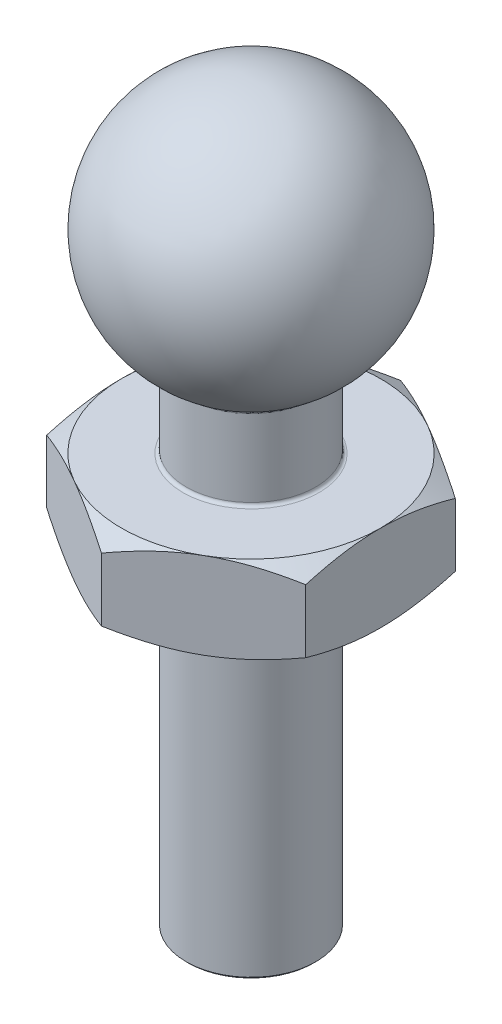
from build123d import *

# Parameters (mm, degrees)
CHAMFER1_SIZE           = 0.05
BOSS_EXTRUDE1_START     = 2
SKETCH3_R               = 1.5
BOSS_EXTRUDE1_DEPTH     = 2
SKETCH5_OUTSIDE_W       = 18.79
SKETCH5_OUTSIDE_H       = 19.718
SKETCH5_OUTSIDE_R       = 3
CUT_EXTRUDE1_DEPTH      = 2
CUT_EXTRUDE1_DRAFT      = -60
MIRROR1_COPY_1_SKETCH_W = 18.79
MIRROR1_COPY_1_SKETCH_H = 19.718
MIRROR1_COPY_1_SKETCH_R = 3
MIRROR1_COPY_1_DEPTH    = 2
MIRROR1_COPY_1_DRAFT    = -60
FILLET1_R               = 0.075


with BuildPart() as part:
    # Sketch1 → Revolve1 (revolve)
    with BuildSketch(Plane.XY):
        with BuildLine():
            Line((0, 17), (0, 0))
            Line((0, 0), (1.5, 0))
            Line((1.5, 0), (1.5, 11.401923789))
            ThreePointArc((1.5, 11.401923789), (2.897777479, 14.776457135), (0, 17))
        make_face()
    revolve(axis=Axis((0, 17, 0), (0, -1, 0)))

    # Chamfer1
    chamfer1_edges = [part.edges().sort_by_distance(p)[0] for p in [
        (-1.5, 0, 0),
    ]]
    chamfer(chamfer1_edges, length=CHAMFER1_SIZE)

    # Sketch3 → Boss-Extrude1 (add)
    with BuildSketch(Plane(origin=(0, 7.5, 0), x_dir=(1, 0, 0), z_dir=(0, 1, 0)).offset(BOSS_EXTRUDE1_START)):
        Polygon((3, 1.732050808), (0, 3.464101615), (-3, 1.732050808), (-3, -1.732050808), (0, -3.464101615), (3, -1.732050808), align=None)
        with Locations(Location((0, 0, 0), (0, 0, 270))):
            Circle(SKETCH3_R, mode=Mode.SUBTRACT)
    extrude(amount=-BOSS_EXTRUDE1_DEPTH)


with BuildPart() as cut_extrude1_tool:
    # Sketch5 outside → Cut-Extrude1 (with draft: the straight prism first)
    with BuildSketch(Plane.XZ.offset(-7.5)):
        Rectangle(SKETCH5_OUTSIDE_W, SKETCH5_OUTSIDE_H)
        Circle(SKETCH5_OUTSIDE_R, mode=Mode.SUBTRACT)
    extrude(amount=-CUT_EXTRUDE1_DEPTH)
    # Cut-Extrude1: the draft: its side faces are tilted about the plane it starts from
    cut_extrude1_sides = [cut_extrude1_tool.faces().sort_by_distance(p)[0] for p in [
        (0, 8.5, -9.859),
        (9.395, 8.5, 0),
        (0, 8.5, 9.859),
        (-9.395, 8.5, 0),
        (-3, 8.5, 0),
    ]]
    draft(cut_extrude1_sides, Plane.XZ.offset(-7.5), CUT_EXTRUDE1_DRAFT)


with BuildPart() as part_1:
    add(part.part)

    # Cut-Extrude1: cut by cut_extrude1_tool
    add(cut_extrude1_tool.part, mode=Mode.SUBTRACT)


with BuildPart() as mirror1_copy_1_tool:
    # Mirror1 copy 1 sketch → Mirror1 copy 1 (with draft: the straight prism first)
    with BuildSketch(Plane(origin=(0, 9.5, 0), x_dir=(1, 0, 0), z_dir=(0, 1, 0))):
        Rectangle(MIRROR1_COPY_1_SKETCH_W, MIRROR1_COPY_1_SKETCH_H)
        Circle(MIRROR1_COPY_1_SKETCH_R, mode=Mode.SUBTRACT)
    extrude(amount=-MIRROR1_COPY_1_DEPTH)
    # Mirror1 copy 1: the draft: its side faces are tilted about the plane it starts from
    mirror1_copy_1_sides = [mirror1_copy_1_tool.faces().sort_by_distance(p)[0] for p in [
        (0, 8.5, -9.859),
        (9.395, 8.5, 0),
        (0, 8.5, 9.859),
        (-9.395, 8.5, 0),
        (-3, 8.5, 0),
    ]]
    draft(mirror1_copy_1_sides, Plane(origin=(0, 9.5, 0), x_dir=(1, 0, 0), z_dir=(0, 1, 0)), MIRROR1_COPY_1_DRAFT)


with BuildPart() as part_2:
    add(part_1.part)

    # Mirror1 copy 1: cut by mirror1_copy_1_tool
    add(mirror1_copy_1_tool.part, mode=Mode.SUBTRACT)

    # Fillet1
    fillet1_edges = [part_2.edges().sort_by_distance(p)[0] for p in [
        (-1.5, 9.5, 0),
        (-1.5, 11.401923789, 0),
    ]]
    fillet(fillet1_edges, radius=FILLET1_R)


solid = part_2.part
